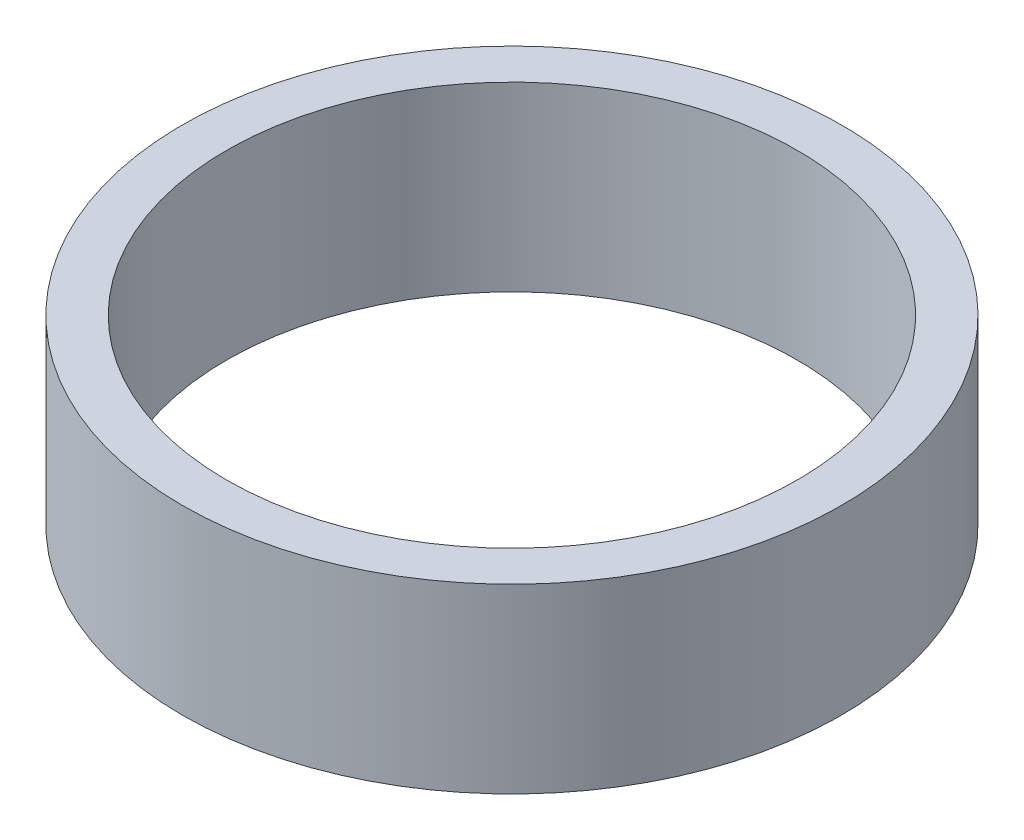
from build123d import *

# Parameters (mm, degrees)
SKETCH1_R           = 12.7
SKETCH1_R_2         = 11
BOSS_EXTRUDE1_DEPTH = 7


with BuildPart() as part:
    # Sketch1 → Boss-Extrude1 (new body)
    with BuildSketch(Plane(origin=(0, 0, 0), x_dir=(1, 0, 0), z_dir=(0, 1, 0))):
        Circle(SKETCH1_R)
        Circle(SKETCH1_R_2, mode=Mode.SUBTRACT)
    extrude(amount=BOSS_EXTRUDE1_DEPTH)


solid = part.part
